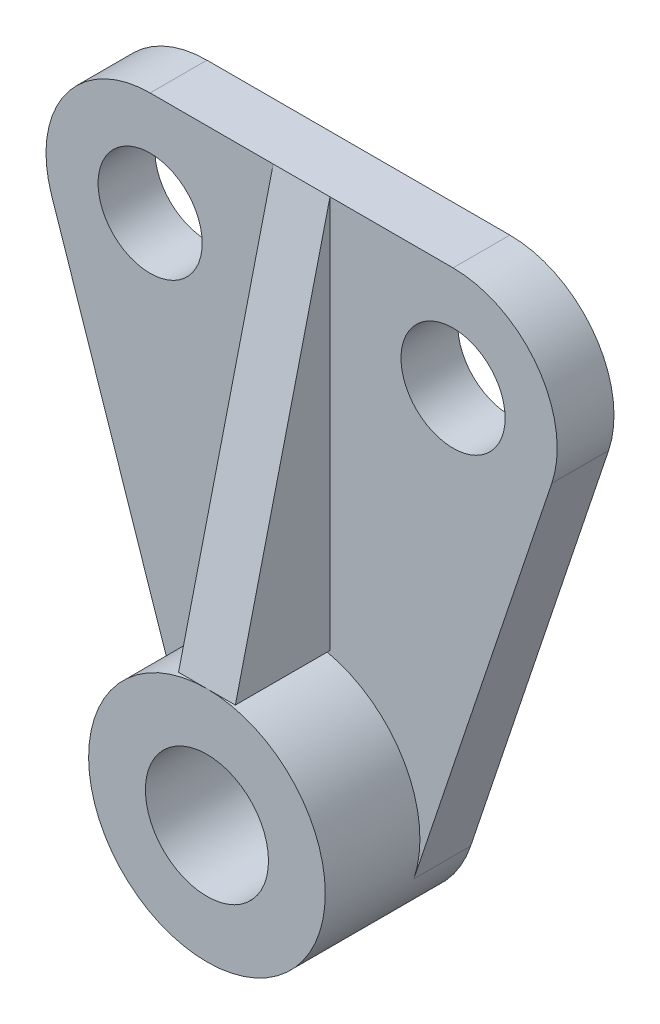
from build123d import *

# Parameters (mm, degrees)
IZIM1_R                           = 11
IZIM1_R_2                         = 13
Y_KSEKLIK_EKSTR_ZYON9_DEPTH       = 12
IZIM11_R                          = 25
Y_KSEKLIK_EKSTR_ZYON10_DEPTH      = 20
KES_EKSTR_ZYON4_REACH             = 126.619
IZIM12_R                          = 13
Y_KSEKLIK_EKSTR_ZYON32_DEPTH      = 20
Y_KSEKLIK_EKSTR_ZYON32_DEPTH_BACK = 1
IZIM13_W                          = 12
IZIM13_H                          = 83
KES_EKSTR_ZYON5_DEPTH             = 12


with BuildPart() as part:
    # Çizim1 → Yükseklik-Ekstrüzyon9 (new body)
    with BuildSketch(Plane.XY):
        with BuildLine():
            Line((-74.025903813, 60.302190491), (-10.025903813, 60.302190491))
            ThreePointArc((-10.025903813, 60.302190491), (7.832798293, 51.150021402), (10.832785726, 31.3082595))
            Line((10.832785726, 31.3082595), (-18.322847519, -55.645458362))
            ThreePointArc((-18.322847519, -55.645458362), (-42.025903813, -72.697809509), (-65.728960107, -55.645458362))
            Line((-65.728960107, -55.645458362), (-94.884593352, 31.3082595))
            ThreePointArc((-94.884593352, 31.3082595), (-91.884605919, 51.150021402), (-74.025903813, 60.302190491))
        make_face()
        with Locations((-74.025903813, 38.302190491)):
            Circle(IZIM1_R, mode=Mode.SUBTRACT)
        with Locations((-10.025903813, 38.302190491)):
            Circle(IZIM1_R, mode=Mode.SUBTRACT)
        with Locations((-42.025903813, -47.697809509)):
            Circle(IZIM1_R_2, mode=Mode.SUBTRACT)
    extrude(amount=Y_KSEKLIK_EKSTR_ZYON9_DEPTH)

    # Çizim11 → Yükseklik-Ekstrüzyon10 (add)
    with BuildSketch(Plane.XY.offset(12)):
        with Locations(Location((-42.025903813, -47.697809509, 0), (0, 0, 198.536333039))):
            Circle(IZIM11_R)
    extrude(amount=Y_KSEKLIK_EKSTR_ZYON10_DEPTH)

    # Çizim12 → Kes-Ekstrüzyon4 (cut, up to next)
    with BuildSketch(Plane.XY.offset(32), mode=Mode.PRIVATE) as kes_ekstr_zyon4_sk1:
        with Locations((-42.025903813, -47.697809509)):
            Circle(IZIM12_R)
    kes_ekstr_zyon4_tool1 = extrude(kes_ekstr_zyon4_sk1.sketch, amount=-KES_EKSTR_ZYON4_REACH, mode=Mode.PRIVATE) & part.part
    add(kes_ekstr_zyon4_tool1.solids().sort_by_distance((-42.025904, -47.69781, 32))[0], mode=Mode.SUBTRACT)


with BuildPart() as body_2:
    # Çizim13 → Yükseklik-Ekstrüzyon32 (new, two sides: drawn at the far end of the back side and taken through both)
    with BuildSketch(Plane.XY.offset(12).offset(-Y_KSEKLIK_EKSTR_ZYON32_DEPTH_BACK)):
        with Locations((-42.025903813, 18.802190491)):
            Rectangle(IZIM13_W, IZIM13_H)
    extrude(amount=Y_KSEKLIK_EKSTR_ZYON32_DEPTH + Y_KSEKLIK_EKSTR_ZYON32_DEPTH_BACK)

    # Çizim14 → Kes-Ekstrüzyon5 (cut)
    with BuildSketch(Plane.ZY.offset(48.025903813)):
        Polygon((12, 60.302190491), (32, -22.697809509), (32, 60.302190491), align=None)
    extrude(amount=-KES_EKSTR_ZYON5_DEPTH, mode=Mode.SUBTRACT)


solid = Compound([part.part, body_2.part])
